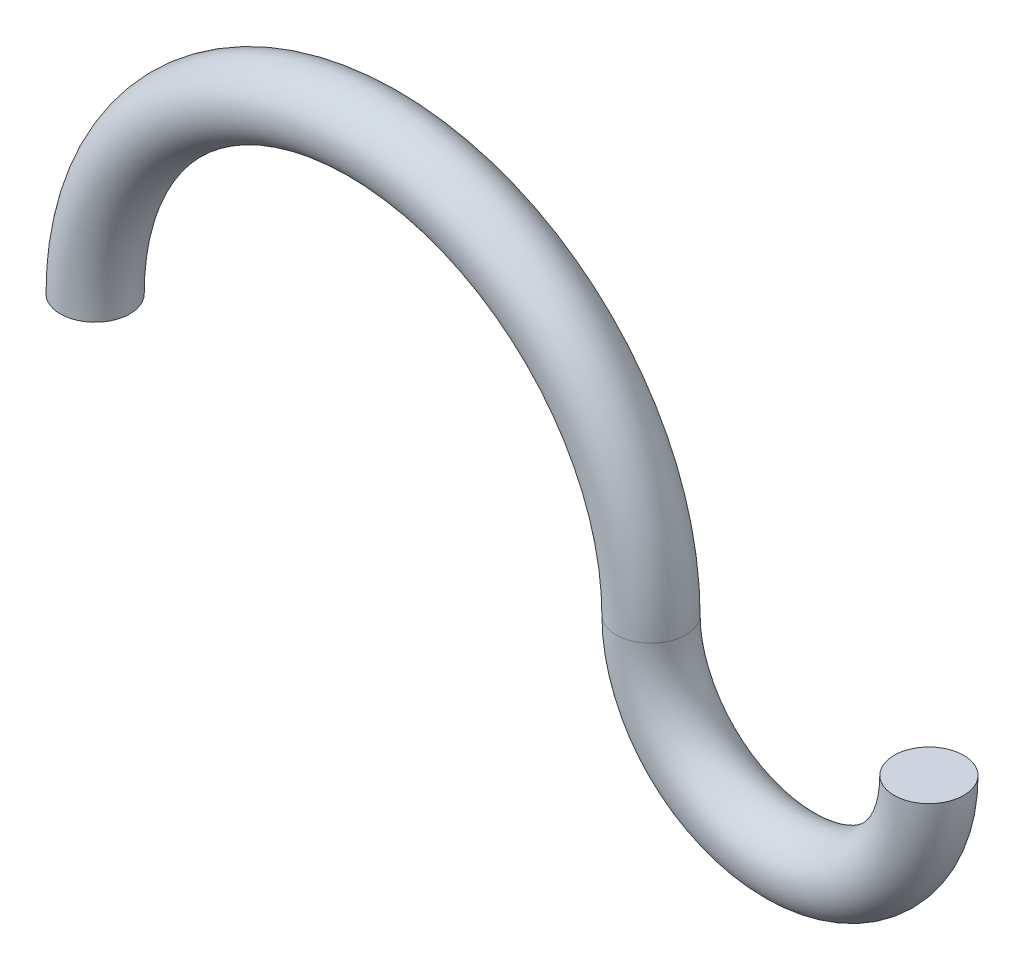
from build123d import *

# Parameters (mm, degrees)
SKETCH_2_R = 2.5


with BuildPart() as part:
    # 扫描1: sweep along a path in 草图1
    with BuildLine(Plane.XY) as sweep_1_path:
        ThreePointArc((10, 0), (0, -10), (-10, 0))
        ThreePointArc((-10, 0), (-30, 20), (-50, 0))
    # 草图2 → 扫描1 (sweep)
    with BuildSketch(Plane(origin=(0, 0, 0), x_dir=(1, 0, 0), z_dir=(0, 1, 0))):
        with Locations((-50, 0)):
            Circle(SKETCH_2_R)
    sweep(path=sweep_1_path.line)


solid = part.part
